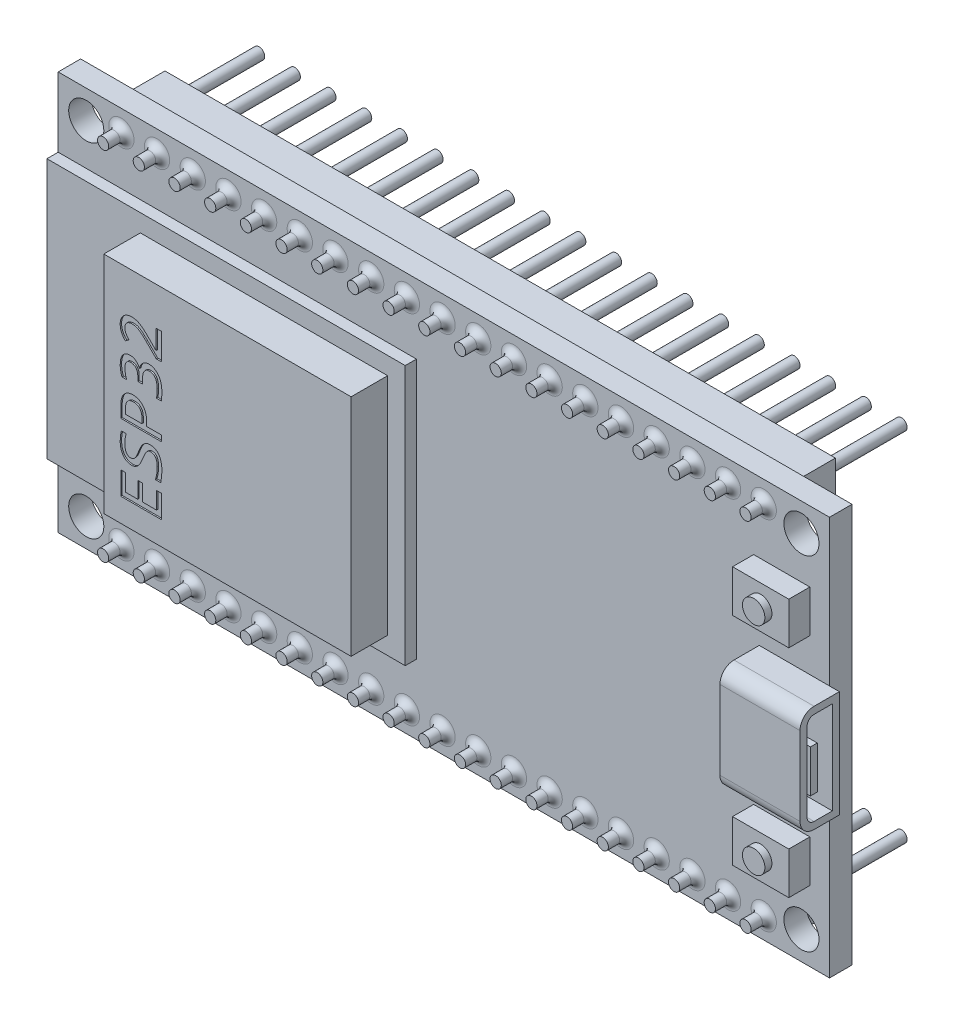
from build123d import *

# Parameters (mm, degrees)
SKETCH1_W           = 54.9
SKETCH1_H           = 28.4
SKETCH1_R           = 1.25
BOSS_EXTRUDE1_DEPTH = 1.6
BOSS_EXTRUDE2_DEPTH = 2.8
FILLET1_R           = 1
SKETCH3_W           = 0.489205705
SKETCH3_H           = 3.024180721
CUT_EXTRUDE1_DEPTH  = 5
SKETCH4_W           = 4
SKETCH4_H           = 3
BOSS_EXTRUDE3_DEPTH = 1.5
SKETCH5_R           = 0.8
BOSS_EXTRUDE4_DEPTH = 0.5
SKETCH6_W           = 25.5
SKETCH6_H           = 18.5
BOSS_EXTRUDE5_DEPTH = 0.8
SKETCH7_W           = 17.6
SKETCH7_H           = 16
BOSS_EXTRUDE6_DEPTH = 2.6
CUT_EXTRUDE2_DEPTH  = 0.1
SKETCH9_R           = 0.4
BOSS_EXTRUDE7_DEPTH = 1.3
BOSS_EXTRUDE8_START = -9.8
SKETCH9_2_R         = 0.4
BOSS_EXTRUDE8_DEPTH = 9.8
FILLET2_R           = 0.5
SKETCH10_W          = 47.72
SKETCH10_H          = 2.51
BOSS_EXTRUDE9_DEPTH = 2.5


with BuildPart() as part:
    # Sketch1 → Boss-Extrude1 (new body)
    with BuildSketch(Plane.XY):
        with Locations((27.45, 14.2)):
            Rectangle(SKETCH1_W, SKETCH1_H)
        with Locations((2, 26.4)):
            Circle(SKETCH1_R, mode=Mode.SUBTRACT)
        with Locations((52.9, 26.4)):
            Circle(SKETCH1_R, mode=Mode.SUBTRACT)
        with Locations((2, 2)):
            Circle(SKETCH1_R, mode=Mode.SUBTRACT)
        with Locations((52.9, 2)):
            Circle(SKETCH1_R, mode=Mode.SUBTRACT)
    extrude(amount=BOSS_EXTRUDE1_DEPTH)

    # Sketch2 → Boss-Extrude2 (add)
    with BuildSketch(Plane.XY.offset(1.6)):
        Polygon((54.9, 18), (49.9, 18), (49.9, 10.4), (54.9, 10.4), (55.6, 10.4), (55.6, 18), align=None)
    extrude(amount=BOSS_EXTRUDE2_DEPTH)

    # Fillet1
    fillet1_edges = [part.edges().sort_by_distance(p)[0] for p in [
        (52.75, 18, 4.4),
        (52.75, 10.4, 4.4),
    ]]
    fillet(fillet1_edges, radius=FILLET1_R)

    # Sketch3 → Cut-Extrude1 (cut)
    with BuildSketch(Plane(origin=(55.6, 0, 0), x_dir=(0, 0, -1), z_dir=(1, 0, 0))):
        with BuildLine():
            Line((-2.1, 17.5), (-3.4, 17.5))
            ThreePointArc((-3.4, 17.5), (-3.753553391, 17.353553391), (-3.9, 17))
            Line((-3.9, 17), (-3.9, 11.4))
            ThreePointArc((-3.9, 11.4), (-3.753553391, 11.046446609), (-3.4, 10.9))
            Line((-3.4, 10.9), (-2.1, 10.9))
            Line((-2.1, 10.9), (-2.1, 17.5))
        make_face()
        with Locations((-3.417595476, 14.11048563)):
            Rectangle(SKETCH3_W, SKETCH3_H, mode=Mode.SUBTRACT)
    extrude(amount=-CUT_EXTRUDE1_DEPTH, mode=Mode.SUBTRACT)

    # Sketch4 → Boss-Extrude3 (add)
    with BuildSketch(Plane.XY.offset(1.6)):
        with Locations((51.5, 21.9)):
            Rectangle(SKETCH4_W, SKETCH4_H)
        with Locations((51.5, 6.5)):
            Rectangle(SKETCH4_W, SKETCH4_H)
    extrude(amount=BOSS_EXTRUDE3_DEPTH)

    # Sketch5 → Boss-Extrude4 (add)
    with BuildSketch(Plane.XY.offset(3.1)):
        with Locations((51.5, 21.9)):
            Circle(SKETCH5_R)
        with Locations((51.5, 6.5)):
            Circle(SKETCH5_R)
    extrude(amount=BOSS_EXTRUDE4_DEPTH)

    # Sketch6 → Boss-Extrude5 (add)
    with BuildSketch(Plane.XY.offset(1.6)):
        with Locations((12.75, 14.2)):
            Rectangle(SKETCH6_W, SKETCH6_H)
    extrude(amount=BOSS_EXTRUDE5_DEPTH)

    # Sketch7 → Boss-Extrude6 (add)
    with BuildSketch(Plane.XY.offset(2.4)):
        with Locations((15.45, 14.2)):
            Rectangle(SKETCH7_W, SKETCH7_H)
    extrude(amount=BOSS_EXTRUDE6_DEPTH)

    # Sketch8 → Cut-Extrude2 (cut)
    # profile 1 of 5: a face of its own
    with BuildSketch(Plane.XY.offset(5)):
        with BuildLine():
            Line((10.738577218, 19.485077523), (10.738577218, 17.605515809))
            Line((10.738577218, 17.605515809), (10.38420152, 17.605515809))
            Line((10.38420152, 17.605515809), (9.650650351, 18.331235471))
            add(Edge.make_bspline(
                [(9.650650351, 18.331235471), (9.621736048, 18.359533503), (9.566322153, 18.413766325), (9.486505819, 18.491312946), (9.411070001, 18.559015302), (9.341667701, 18.619541453), (9.276767273, 18.67317388), (9.214576426, 18.719276682), (9.156058738, 18.760322093), (9.099485204, 18.794145067), (9.04575919, 18.823531427), (8.993242339, 18.846850225), (8.942528957, 18.866458053), (8.875189818, 18.883420175), (8.788697366, 18.897750989), (8.718335305, 18.899450879), (8.682153967, 18.90032499)],
                knots=[0, 0, 0, 0, 1.467781628, 2.812984966, 4.036667351, 5.144376027, 6.153886057, 7.089890156, 7.952406517, 8.745552503, 9.479984163, 10.172333011, 10.829086416, 11.449306875, 12.688391322, 14, 14, 14, 14], degree=3))
            add(Edge.make_bspline(
                [(8.682153967, 18.90032499), (8.647237101, 18.898950291), (8.578288841, 18.896235755), (8.494414603, 18.878104905), (8.430917501, 18.857779569), (8.387138734, 18.836990652), (8.345673986, 18.813559914), (8.307056745, 18.78637151), (8.272372916, 18.754515343), (8.2402365, 18.719384756), (8.214131523, 18.678201114), (8.189886147, 18.633996088), (8.172037638, 18.58437503), (8.158009144, 18.530733893), (8.150391299, 18.472201804), (8.149446968, 18.431759742), (8.148958856, 18.410855794)],
                knots=[0, 0, 0, 0, 1.786216299, 3.527135121, 4.372416622, 5.194637262, 6.0027823, 6.80939094, 7.605785013, 8.410469029, 9.238327819, 10.095268927, 10.986900131, 11.929653777, 12.929866349, 14, 14, 14, 14], degree=3))
            add(Edge.make_bspline(
                [(8.148958856, 18.410855794), (8.150002954, 18.381645022), (8.152066227, 18.323920733), (8.167220582, 18.239370488), (8.192973898, 18.158971451), (8.22854969, 18.082942429), (8.272988448, 18.011083026), (8.323267325, 17.94220142), (8.378856271, 17.875438779), (8.420314573, 17.834473796), (8.441335123, 17.813703374)],
                knots=[0, 0, 0, 0, 1.023841796, 2.023244705, 3.000130015, 3.976032288, 4.95838074, 5.957638122, 6.964463877, 8, 8, 8, 8], degree=3))
            Line((8.441335123, 17.813703374), (8.190074268, 17.605515809))
            add(Edge.make_bspline(
                [(8.190074268, 17.605515809), (8.162538759, 17.632846628), (8.107639506, 17.687337778), (8.035447269, 17.778110376), (7.971232888, 17.874365257), (7.914980523, 17.976687447), (7.869293189, 18.086862526), (7.837619871, 18.205995257), (7.818457104, 18.33344084), (7.816050778, 18.421228752), (7.814814551, 18.466328969)],
                knots=[0, 0, 0, 0, 0.961904287, 1.917808245, 2.871393154, 3.830279184, 4.810558542, 5.822670133, 6.881417188, 8, 8, 8, 8], degree=3))
            add(Edge.make_bspline(
                [(7.814814551, 18.466328969), (7.815284462, 18.497259929), (7.816204368, 18.557810961), (7.828028279, 18.646374328), (7.845324741, 18.730958857), (7.869858842, 18.811354862), (7.90243033, 18.88657433), (7.939602795, 18.9573623), (7.984904623, 19.021934002), (8.035671541, 19.08131574), (8.092615743, 19.135450946), (8.15648166, 19.182054665), (8.22520774, 19.224039044), (8.30090082, 19.257464264), (8.381497994, 19.285329796), (8.467673777, 19.303601521), (8.558230785, 19.315979284), (8.62032783, 19.317319122), (8.65213319, 19.318005371)],
                knots=[0, 0, 0, 0, 1.101024146, 2.155385717, 3.176652834, 4.17421508, 5.142857198, 6.092783762, 7.017080387, 7.945816332, 8.872221856, 9.808299192, 10.757150569, 11.735138951, 12.749622124, 13.789302431, 14.867707268, 16, 16, 16, 16], degree=3))
            add(Edge.make_bspline(
                [(8.65213319, 19.318005371), (8.679124298, 19.317496786), (8.732352465, 19.316493824), (8.810525731, 19.308798331), (8.885515664, 19.294857117), (8.957923718, 19.275806552), (9.028878423, 19.251247911), (9.099536139, 19.22211486), (9.169408619, 19.186360978), (9.239695831, 19.145828981), (9.310015852, 19.098954895), (9.382273909, 19.047737886), (9.45430958, 18.988894764), (9.529116192, 18.92579255), (9.605219262, 18.855783155), (9.685995286, 18.781707537), (9.769255183, 18.700453022), (9.825822657, 18.644111088), (9.854922162, 18.615127605)],
                knots=[0, 0, 0, 0, 0.903006108, 1.780784919, 2.6244971, 3.452490889, 4.283422647, 5.135009645, 6.007370111, 6.907467505, 7.848200552, 8.833923043, 9.869470176, 10.958941075, 12.108048799, 13.328693938, 14.62582365, 16, 16, 16, 16], degree=3))
            Line((9.854922162, 18.615127605), (10.362664875, 18.106732266))
            Line((10.362664875, 18.106732266), (10.362664875, 19.485077523))
            Line((10.362664875, 19.485077523), (10.738577218, 19.485077523))
        make_face()
    # profile 2 of 5: a face of its own
    with BuildSketch(Plane.XY.offset(5)):
        with BuildLine():
            add(Edge.make_bspline(
                [(9.851659034, 17.020763276), (9.883249543, 17.019653823), (9.945883565, 17.017454128), (10.038410423, 17.003086694), (10.127780775, 16.977815434), (10.214058073, 16.943538525), (10.295821925, 16.898537581), (10.373613677, 16.845430656), (10.444251937, 16.780099765), (10.510440116, 16.706322675), (10.570676272, 16.622470458), (10.623625448, 16.528206489), (10.669838379, 16.423892055), (10.709576751, 16.30959009), (10.741551692, 16.185452586), (10.764110075, 16.051419999), (10.777927689, 15.907675442), (10.779522957, 15.808434844), (10.780345256, 15.757280123)],
                knots=[0, 0, 0, 0, 0.862000906, 1.709076045, 2.547265718, 3.391591147, 4.236250351, 5.089190827, 5.954842265, 6.854464594, 7.790140503, 8.765673628, 9.799288264, 10.899351906, 12.064056353, 13.292653574, 14.604466791, 16, 16, 16, 16], degree=3))
            add(Edge.make_bspline(
                [(10.780345256, 15.757280123), (10.780078733, 15.702004152), (10.779573596, 15.597240275), (10.769549857, 15.447754456), (10.756934251, 15.311438446), (10.744570811, 15.224914833), (10.738577218, 15.182969599)],
                knots=[0, 0, 0, 0, 1.150537757, 2.180600223, 3.117984723, 4, 4, 4, 4], degree=3))
            Line((10.738577218, 15.182969599), (10.404432913, 15.182969599))
            add(Edge.make_bspline(
                [(10.404432913, 15.182969599), (10.410679599, 15.230352788), (10.423463202, 15.327320672), (10.435870677, 15.476706681), (10.444944674, 15.631429595), (10.445780068, 15.736382192), (10.446200951, 15.789258777)],
                knots=[0, 0, 0, 0, 0.942848368, 1.929503111, 2.956854718, 4, 4, 4, 4], degree=3))
            add(Edge.make_bspline(
                [(10.446200951, 15.789258777), (10.445660305, 15.824293118), (10.444614755, 15.892045703), (10.437780955, 15.98950741), (10.425272627, 16.079070487), (10.408486757, 16.160889786), (10.387268446, 16.235458982), (10.360958009, 16.302724505), (10.330644407, 16.362833053), (10.295610585, 16.415669047), (10.256983848, 16.462042293), (10.213829503, 16.501186365), (10.166770957, 16.533929193), (10.115520535, 16.559155904), (10.061105524, 16.578579558), (10.003504136, 16.593325343), (9.942408575, 16.601741262), (9.900413574, 16.602630787), (9.879069309, 16.603082895)],
                knots=[0, 0, 0, 0, 1.490206093, 2.881895635, 4.152536341, 5.33392715, 6.432085301, 7.445878695, 8.401816679, 9.289775243, 10.136874663, 10.962216482, 11.760452457, 12.567382849, 13.384016582, 14.214374466, 15.092442814, 16, 16, 16, 16], degree=3))
            add(Edge.make_bspline(
                [(9.879069309, 16.603082895), (9.859670605, 16.602475787), (9.821916859, 16.601294236), (9.767102273, 16.591539723), (9.716582208, 16.574237192), (9.669704251, 16.551396017), (9.627103575, 16.522101213), (9.587413187, 16.488175307), (9.552308688, 16.44773813), (9.520073227, 16.402665433), (9.492406614, 16.352296215), (9.467839298, 16.297615633), (9.448046337, 16.237998438), (9.430996385, 16.174191289), (9.418142921, 16.106549641), (9.409197274, 16.035481944), (9.40304489, 15.961441596), (9.402351957, 15.910877505), (9.401999999, 15.88519474)],
                knots=[0, 0, 0, 0, 0.962577253, 1.873367235, 2.750969479, 3.605753726, 4.453345862, 5.310718099, 6.190443685, 7.104301169, 8.056648313, 9.037941432, 10.076053636, 11.170911826, 12.314528068, 13.490518149, 14.725371476, 16, 16, 16, 16], degree=3))
            Line((9.401999999, 15.88519474), (9.401999999, 15.558881942))
            Line((9.401999999, 15.558881942), (9.067855694, 15.558881942))
            Line((9.067855694, 15.558881942), (9.067855694, 15.894984124))
            add(Edge.make_bspline(
                [(9.067855694, 15.894984124), (9.06755204, 15.91632193), (9.066955618, 15.958232463), (9.060143796, 16.019504536), (9.049776517, 16.077967035), (9.035497866, 16.133429703), (9.017381262, 16.185710158), (8.995227208, 16.233965867), (8.969508421, 16.278399369), (8.940064272, 16.318713553), (8.907733616, 16.355768804), (8.870406513, 16.387223384), (8.830021734, 16.414748137), (8.785944293, 16.437567966), (8.739068246, 16.456169563), (8.688501744, 16.468236869), (8.635213481, 16.476394748), (8.598432607, 16.477311613), (8.579691749, 16.47777878)],
                knots=[0, 0, 0, 0, 1.192955268, 2.343136477, 3.443387262, 4.511688449, 5.542971428, 6.533842038, 7.477103137, 8.409233689, 9.322674014, 10.220090696, 11.131259182, 12.050998613, 12.990958013, 13.944133247, 14.952479831, 16, 16, 16, 16], degree=3))
            add(Edge.make_bspline(
                [(8.579691749, 16.47777878), (8.561606135, 16.477543867), (8.526367423, 16.477086153), (8.475720838, 16.469518232), (8.428608996, 16.458614348), (8.385372854, 16.442991974), (8.345781636, 16.422717972), (8.310205271, 16.397448873), (8.277881451, 16.368274773), (8.250585008, 16.33360422), (8.226104227, 16.295449706), (8.205257675, 16.252696237), (8.187950141, 16.205824825), (8.173311591, 16.1548229), (8.16254654, 16.099769688), (8.154943253, 16.0404606), (8.149267729, 15.977105863), (8.149064069, 15.933285364), (8.148958856, 15.910647138)],
                knots=[0, 0, 0, 0, 1.063902117, 2.07294813, 3.008146373, 3.907750858, 4.772858431, 5.618688894, 6.470897239, 7.327139502, 8.208408171, 9.136473106, 10.121490767, 11.14730967, 12.257700006, 13.420778618, 14.667541449, 16, 16, 16, 16], degree=3))
            add(Edge.make_bspline(
                [(8.148958856, 15.910647138), (8.150527186, 15.860310314), (8.153734257, 15.757376819), (8.174349597, 15.628384079), (8.197643088, 15.52239848), (8.21928763, 15.439478046), (8.244795784, 15.353729514), (8.264288094, 15.296031635), (8.27426297, 15.266505675)],
                knots=[0, 0, 0, 0, 1.374009053, 2.809703548, 3.557729416, 4.33717134, 5.149074242, 6, 6, 6, 6], degree=3))
            Line((8.27426297, 15.266505675), (7.940118665, 15.266505675))
            add(Edge.make_bspline(
                [(7.940118665, 15.266505675), (7.930465258, 15.292945746), (7.910776028, 15.346873299), (7.886532187, 15.430706937), (7.865374821, 15.516778075), (7.846593751, 15.603475622), (7.833381313, 15.690300114), (7.822811257, 15.776015262), (7.81586483, 15.859845666), (7.815159681, 15.914985403), (7.814814551, 15.941973167)],
                knots=[0, 0, 0, 0, 0.97828254, 1.995319307, 3.031658837, 4.059547585, 5.077848887, 6.083433287, 7.061949656, 8, 8, 8, 8], degree=3))
            add(Edge.make_bspline(
                [(7.814814551, 15.941973167), (7.815436186, 15.980063923), (7.816638725, 16.053749596), (7.826013449, 16.160755601), (7.840529303, 16.260741436), (7.862018271, 16.353721883), (7.889654825, 16.439279568), (7.921230395, 16.518298448), (7.959110351, 16.589607781), (8.002408703, 16.653549296), (8.050939712, 16.709909417), (8.104142882, 16.759460155), (8.16241408, 16.801442492), (8.225714801, 16.835542445), (8.293416138, 16.862350902), (8.365127387, 16.882064834), (8.441207611, 16.893148408), (8.49307495, 16.89467631), (8.519650194, 16.895459161)],
                knots=[0, 0, 0, 0, 1.364362879, 2.639327927, 3.845081581, 4.981203076, 6.053296419, 7.063437936, 8.025666777, 8.939996343, 9.824170202, 10.68446093, 11.538765414, 12.389614983, 13.253568937, 14.142128063, 15.048083035, 16, 16, 16, 16], degree=3))
            add(Edge.make_bspline(
                [(8.519650194, 16.895459161), (8.539456767, 16.895070113), (8.578506404, 16.894303084), (8.635980949, 16.888632979), (8.690789413, 16.877764307), (8.743450302, 16.864573744), (8.79323384, 16.845788392), (8.841159968, 16.823942683), (8.886008217, 16.79685039), (8.943267949, 16.756406212), (9.009483262, 16.69699519), (9.079505976, 16.613484873), (9.142642012, 16.519180008), (9.175159843, 16.44913175), (9.191854557, 16.413168846)],
                knots=[0, 0, 0, 0, 0.808629916, 1.594253862, 2.353688901, 3.088257457, 3.807581306, 4.522781345, 5.235606306, 5.942821229, 7.383249685, 8.851339496, 10.383471904, 12, 12, 12, 12], degree=3))
            add(Edge.make_bspline(
                [(9.191854557, 16.413168846), (9.19959452, 16.450496254), (9.21527422, 16.526114511), (9.261144286, 16.634518318), (9.321375388, 16.737249532), (9.385903867, 16.813857061), (9.4439126, 16.869130505), (9.492333341, 16.905708655), (9.543484324, 16.93983063), (9.598954473, 16.968201045), (9.657555481, 16.991924938), (9.719451998, 17.009097981), (9.784554365, 17.018941404), (9.829001374, 17.020148127), (9.851659034, 17.020763276)],
                knots=[0, 0, 0, 0, 1.405029343, 2.846323322, 4.323450548, 5.789369391, 6.528282537, 7.278767976, 8.027531129, 8.796539371, 9.575348541, 10.358950429, 11.163445528, 12, 12, 12, 12], degree=3))
        make_face()
    # profile 3 of 5: a face of its own
    with BuildSketch(Plane.XY.offset(5)):
        with BuildLine():
            add(Edge.make_bspline(
                [(8.733711389, 14.556449028), (8.76290704, 14.555744482), (8.82156085, 14.554329057), (8.90911765, 14.541236841), (8.996232185, 14.521024691), (9.082391651, 14.49297144), (9.166438811, 14.457077871), (9.246060509, 14.410602849), (9.321162534, 14.35580758), (9.391437334, 14.291989115), (9.456326968, 14.219411673), (9.514594313, 14.136909956), (9.566848776, 14.045450821), (9.611899935, 13.944279188), (9.649483139, 13.833771717), (9.676063543, 13.712574009), (9.691575115, 13.581181086), (9.693422365, 13.490102018), (9.694376266, 13.443069762)],
                knots=[0, 0, 0, 0, 0.848366681, 1.70436134, 2.568101873, 3.44615045, 4.335605672, 5.219738008, 6.120455434, 7.033895829, 7.974606513, 8.94512196, 9.964958472, 11.032269508, 12.160312669, 13.352609154, 14.632915689, 16, 16, 16, 16], degree=3))
            Line((9.694376266, 13.443069762), (9.694376266, 13.094567694))
            Line((9.694376266, 13.094567694), (10.738577218, 13.094567694))
            Line((10.738577218, 13.094567694), (10.738577218, 12.676887313))
            Line((10.738577218, 12.676887313), (7.856582589, 12.676887313))
            Line((7.856582589, 12.676887313), (7.856582589, 13.482879923))
            add(Edge.make_bspline(
                [(7.856582589, 13.482879923), (7.857330751, 13.517915882), (7.858815261, 13.587434515), (7.866987287, 13.690615346), (7.882618217, 13.791347658), (7.901942294, 13.889797107), (7.929498037, 13.984003449), (7.962858515, 14.073395453), (8.005384176, 14.156105515), (8.0540305, 14.233572822), (8.110911282, 14.304144895), (8.175297946, 14.367532191), (8.247939135, 14.422501655), (8.327821064, 14.470638831), (8.416618931, 14.509713074), (8.514713226, 14.536397425), (8.621253178, 14.55414564), (8.695346406, 14.55566323), (8.733711389, 14.556449028)],
                knots=[0, 0, 0, 0, 1.071168916, 2.125422097, 3.160883342, 4.185978661, 5.189866953, 6.158124041, 7.097919914, 8.02771025, 8.949955167, 9.862244431, 10.782641377, 11.728090455, 12.707834548, 13.737299276, 14.82838854, 16, 16, 16, 16], degree=3))
        make_face()
        with BuildLine():
            add(Edge.make_bspline(
                [(8.755900659, 14.138768647), (8.733681641, 14.138351999), (8.690375944, 14.137539936), (8.627660829, 14.128810695), (8.568873437, 14.115064606), (8.514064716, 14.096340446), (8.463071518, 14.072067155), (8.416591395, 14.041716326), (8.373654237, 14.006249555), (8.335272707, 13.965065952), (8.301487309, 13.918974698), (8.270947387, 13.869359328), (8.246268501, 13.814620215), (8.226262508, 13.7555105), (8.209631689, 13.692356616), (8.199165617, 13.624546245), (8.191394675, 13.552890972), (8.190953054, 13.503569701), (8.190726894, 13.478311544)],
                knots=[0, 0, 0, 0, 1.07893025, 2.102875295, 3.069403633, 4.00867391, 4.911619206, 5.805799344, 6.69897942, 7.61127936, 8.532960211, 9.47193309, 10.436783978, 11.442898866, 12.50165651, 13.605056338, 14.773513735, 16, 16, 16, 16], degree=3))
            Line((8.190726894, 13.478311544), (8.190726894, 13.094567694))
            Line((8.190726894, 13.094567694), (9.360231961, 13.094567694))
            Line((9.360231961, 13.094567694), (9.360231961, 13.445027639))
            add(Edge.make_bspline(
                [(9.360231961, 13.445027639), (9.359638468, 13.472012628), (9.358488003, 13.524322095), (9.352239842, 13.600713984), (9.340417141, 13.672220264), (9.324562596, 13.739247828), (9.302504772, 13.800756668), (9.277422535, 13.858210447), (9.246433726, 13.910547001), (9.211227624, 13.958408791), (9.171335301, 14.001423071), (9.125717971, 14.037959221), (9.075956543, 14.069576998), (9.021152088, 14.095277308), (8.961405697, 14.114513665), (8.897222425, 14.128953422), (8.828140059, 14.137539428), (8.780507772, 14.138349934), (8.755900659, 14.138768647)],
                knots=[0, 0, 0, 0, 1.232741143, 2.389626019, 3.497154964, 4.540654912, 5.530551031, 6.477891969, 7.399827849, 8.302062897, 9.187787369, 10.070776652, 10.963938254, 11.875156404, 12.827227449, 13.825219082, 14.876495724, 16, 16, 16, 16], degree=3))
        make_face(mode=Mode.SUBTRACT)
    # profile 4 of 5: a face of its own
    with BuildSketch(Plane.XY.offset(5)):
        with BuildLine():
            add(Edge.make_bspline(
                [(9.958689632, 12.09213478), (9.992033274, 12.091174562), (10.05693399, 12.089305576), (10.151128493, 12.073559711), (10.238509492, 12.046566031), (10.319709315, 12.009765472), (10.393976826, 11.963255101), (10.462221072, 11.90837498), (10.52358692, 11.845001286), (10.577831935, 11.772929064), (10.626539626, 11.693882366), (10.667315317, 11.606200934), (10.702596817, 11.511534381), (10.731127429, 11.409540307), (10.752900557, 11.301059083), (10.769480132, 11.186941773), (10.778323888, 11.06721871), (10.779662497, 10.985729873), (10.780345256, 10.944166358)],
                knots=[0, 0, 0, 0, 1.005542668, 1.957207907, 2.870649987, 3.757654935, 4.639106304, 5.50728757, 6.393806754, 7.292990278, 8.223879093, 9.189763998, 10.205281347, 11.269088171, 12.381198635, 13.541420952, 14.745997712, 16, 16, 16, 16], degree=3))
            add(Edge.make_bspline(
                [(10.780345256, 10.944166358), (10.780011847, 10.905868558), (10.779346532, 10.829445774), (10.77268222, 10.715912521), (10.7654551, 10.604663933), (10.754553149, 10.497693302), (10.743465177, 10.395499283), (10.728616943, 10.299915882), (10.714371664, 10.211387653), (10.7024607, 10.155537024), (10.69680918, 10.129036989)],
                knots=[0, 0, 0, 0, 1.119774364, 2.234495903, 3.324975685, 4.379535058, 5.378502437, 6.330339078, 7.20777842, 8, 8, 8, 8], degree=3))
            Line((10.69680918, 10.129036989), (10.320896837, 10.129036989))
            add(Edge.make_bspline(
                [(10.320896837, 10.129036989), (10.330622497, 10.157422271), (10.35049447, 10.215420554), (10.373802491, 10.306396263), (10.395692325, 10.401826801), (10.413979919, 10.502618982), (10.428373151, 10.609754766), (10.438495736, 10.723642911), (10.445350668, 10.844666002), (10.445912245, 10.927623094), (10.446200951, 10.970271381)],
                knots=[0, 0, 0, 0, 0.842364813, 1.72116351, 2.635659137, 3.591954833, 4.596841017, 5.670471508, 6.802388115, 8, 8, 8, 8], degree=3))
            add(Edge.make_bspline(
                [(10.446200951, 10.970271381), (10.445887289, 11.00074153), (10.445283975, 11.059349531), (10.438976458, 11.143800674), (10.430753056, 11.221350483), (10.416469671, 11.291831856), (10.400029436, 11.355952301), (10.379108465, 11.413908742), (10.354211951, 11.465611356), (10.326299637, 11.511956582), (10.294057099, 11.551689581), (10.259283164, 11.586475441), (10.220429792, 11.614678825), (10.178287026, 11.636813478), (10.133412412, 11.654104919), (10.085326203, 11.665558506), (10.034185927, 11.672932795), (9.998961597, 11.673938244), (9.980878902, 11.674454399)],
                knots=[0, 0, 0, 0, 1.523249472, 2.929903915, 4.233296251, 5.419431577, 6.522341058, 7.540917397, 8.494515215, 9.388156094, 10.239274487, 11.04695073, 11.841108735, 12.62943441, 13.421354294, 14.239221521, 15.096090076, 16, 16, 16, 16], degree=3))
            add(Edge.make_bspline(
                [(9.980878902, 11.674454399), (9.962091386, 11.673806365), (9.925384531, 11.672540243), (9.872723039, 11.659607682), (9.823887846, 11.639387698), (9.780334034, 11.609744232), (9.739411979, 11.574907822), (9.701912588, 11.533983789), (9.665658585, 11.488806211), (9.620029093, 11.420273599), (9.566670899, 11.324166998), (9.511892442, 11.19690817), (9.459358972, 11.060888909), (9.402839877, 10.922101457), (9.343671959, 10.782785215), (9.279306858, 10.647078453), (9.208296195, 10.518181157), (9.135267243, 10.422953143), (9.071447188, 10.354888663), (9.019583311, 10.309394237), (8.962994505, 10.269841609), (8.903218832, 10.233942084), (8.837757208, 10.205477946), (8.766850011, 10.185578941), (8.690239277, 10.172623734), (8.637178747, 10.171425355), (8.609712526, 10.170805027)],
                knots=[0, 0, 0, 0, 0.619856703, 1.211069627, 1.781317632, 2.357652662, 2.944124569, 3.554568585, 4.189016027, 4.857081954, 6.273378886, 7.815244584, 9.432151164, 11.09313998, 12.767999346, 14.433898664, 16.057028127, 17.6216601, 18.384562662, 19.138741378, 19.896851429, 20.66387654, 21.439947467, 22.247841025, 23.093013471, 24, 24, 24, 24], degree=3))
            add(Edge.make_bspline(
                [(8.609712526, 10.170805027), (8.585082956, 10.17155382), (8.535763301, 10.173053245), (8.462067888, 10.185439084), (8.389017218, 10.204919756), (8.316872987, 10.232341992), (8.247320203, 10.268274283), (8.180594308, 10.311957535), (8.119223052, 10.365895169), (8.060674496, 10.427045777), (8.007638774, 10.498347218), (7.960157705, 10.578712754), (7.918512223, 10.668566856), (7.880945756, 10.767038061), (7.851054031, 10.875793544), (7.829658593, 10.994357809), (7.817578231, 11.12273522), (7.815756902, 11.211499997), (7.814814551, 11.257426643)],
                knots=[0, 0, 0, 0, 0.784008501, 1.569943279, 2.373275585, 3.189059721, 4.022597455, 4.862331727, 5.722035901, 6.618905113, 7.554234865, 8.545209567, 9.586587379, 10.704826919, 11.898277364, 13.172984207, 14.537309982, 16, 16, 16, 16], degree=3))
            add(Edge.make_bspline(
                [(7.814814551, 11.257426643), (7.815320011, 11.283101237), (7.816370131, 11.336441658), (7.820935408, 11.418735491), (7.828777679, 11.504471406), (7.839350939, 11.591690421), (7.851572225, 11.678756674), (7.865939555, 11.764235229), (7.881283802, 11.846290481), (7.89279418, 11.899416777), (7.898350627, 11.925062627)],
                knots=[0, 0, 0, 0, 0.914358742, 1.899632051, 2.934074914, 3.979452354, 5.027838988, 6.06445484, 7.065647236, 8, 8, 8, 8], degree=3))
            Line((7.898350627, 11.925062627), (8.232494932, 11.925062627))
            add(Edge.make_bspline(
                [(8.232494932, 11.925062627), (8.219928316, 11.867966173), (8.194912608, 11.754307229), (8.16839842, 11.583520923), (8.152164247, 11.415461567), (8.150014676, 11.304667351), (8.148958856, 11.250247762)],
                knots=[0, 0, 0, 0, 1.029354975, 2.049083439, 3.041754323, 4, 4, 4, 4], degree=3))
            add(Edge.make_bspline(
                [(8.148958856, 11.250247762), (8.149377934, 11.222830656), (8.150190272, 11.169685562), (8.155184782, 11.092746072), (8.164330661, 11.02150593), (8.176700431, 10.955892758), (8.192008204, 10.89572523), (8.211456063, 10.841188519), (8.235194739, 10.792583079), (8.261866643, 10.749091106), (8.292060626, 10.711351146), (8.324115442, 10.67817462), (8.358971563, 10.650475829), (8.396622777, 10.628117029), (8.436568489, 10.610619483), (8.478641662, 10.597030491), (8.523556482, 10.590133561), (8.554219798, 10.589043112), (8.569902365, 10.588485408)],
                knots=[0, 0, 0, 0, 1.491437277, 2.890989782, 4.191431573, 5.395946596, 6.521058188, 7.565423013, 8.539223212, 9.458660202, 10.334655275, 11.163081303, 11.963306063, 12.748694206, 13.538083787, 14.331542868, 15.146677777, 16, 16, 16, 16], degree=3))
            add(Edge.make_bspline(
                [(8.569902365, 10.588485408), (8.588690543, 10.589129041), (8.625398692, 10.590386564), (8.678246752, 10.603428935), (8.727177617, 10.623497744), (8.771615558, 10.652572819), (8.812195024, 10.688076827), (8.851091286, 10.728233233), (8.887670154, 10.773512034), (8.934394604, 10.841956757), (8.987924404, 10.938514807), (9.042652812, 11.066173201), (9.096158098, 11.20189908), (9.152502421, 11.340839616), (9.211540928, 11.480315428), (9.266352, 11.594029489), (9.313425319, 11.682274876), (9.352884603, 11.744116544), (9.394499638, 11.802838401), (9.440484029, 11.856821341), (9.489087143, 11.907524705), (9.542496774, 11.952573454), (9.599097769, 11.993377703), (9.660523192, 12.028177104), (9.726560751, 12.057686434), (9.798991441, 12.077287536), (9.876856627, 12.090331681), (9.930786228, 12.091519959), (9.958689632, 12.09213478)],
                knots=[0, 0, 0, 0, 0.667490157, 1.304135379, 1.925338702, 2.541746512, 3.184203398, 3.84128389, 4.529338779, 5.253104542, 6.788775438, 8.449127214, 10.193159048, 11.981788067, 13.78535353, 15.582625783, 16.473069092, 17.343045967, 18.191816017, 19.032495598, 19.864754018, 20.688614347, 21.515778917, 22.344572585, 23.197569954, 24.082441501, 25.007847132, 26, 26, 26, 26], degree=3))
        make_face()
    # profile 5 of 5: a face of its own
    with BuildSketch(Plane.XY.offset(5)):
        Polygon((10.738577218, 9.502516418), (10.738577218, 7.873562932), (7.856582589, 7.873562932), (7.856582589, 9.502516418), (8.190726894, 9.502516418), (8.190726894, 8.291243313), (9.067855694, 8.291243313), (9.067855694, 9.454222124), (9.401999999, 9.454222124), (9.401999999, 8.291243313), (10.404432913, 8.291243313), (10.404432913, 9.502516418), align=None)
    extrude(amount=-CUT_EXTRUDE2_DEPTH, mode=Mode.SUBTRACT)

    # Sketch9 → Boss-Extrude7 (add)
    with BuildSketch(Plane.XY.offset(1.6)):
        with Locations((4.5, 26.9)):
            Circle(SKETCH9_R)
        with Locations((7.04, 26.9)):
            Circle(SKETCH9_R)
        with Locations((9.58, 26.9)):
            Circle(SKETCH9_R)
        with Locations((12.12, 26.9)):
            Circle(SKETCH9_R)
        with Locations((14.66, 26.9)):
            Circle(SKETCH9_R)
        with Locations((17.2, 26.9)):
            Circle(SKETCH9_R)
        with Locations((19.74, 26.9)):
            Circle(SKETCH9_R)
        with Locations((22.28, 26.9)):
            Circle(SKETCH9_R)
        with Locations((24.82, 26.9)):
            Circle(SKETCH9_R)
        with Locations((27.36, 26.9)):
            Circle(SKETCH9_R)
        with Locations((29.9, 26.9)):
            Circle(SKETCH9_R)
        with Locations((32.44, 26.9)):
            Circle(SKETCH9_R)
        with Locations((34.98, 26.9)):
            Circle(SKETCH9_R)
        with Locations((37.52, 26.9)):
            Circle(SKETCH9_R)
        with Locations((40.06, 26.9)):
            Circle(SKETCH9_R)
        with Locations((42.6, 26.9)):
            Circle(SKETCH9_R)
        with Locations((45.14, 26.9)):
            Circle(SKETCH9_R)
        with Locations((47.68, 26.9)):
            Circle(SKETCH9_R)
        with Locations((50.22, 26.9)):
            Circle(SKETCH9_R)
        with Locations((50.22, 1.5)):
            Circle(SKETCH9_R)
        with Locations((47.68, 1.5)):
            Circle(SKETCH9_R)
        with Locations((45.14, 1.5)):
            Circle(SKETCH9_R)
        with Locations((42.6, 1.5)):
            Circle(SKETCH9_R)
        with Locations((40.06, 1.5)):
            Circle(SKETCH9_R)
        with Locations((37.52, 1.5)):
            Circle(SKETCH9_R)
        with Locations((34.98, 1.5)):
            Circle(SKETCH9_R)
        with Locations((32.44, 1.5)):
            Circle(SKETCH9_R)
        with Locations((29.9, 1.5)):
            Circle(SKETCH9_R)
        with Locations((27.36, 1.5)):
            Circle(SKETCH9_R)
        with Locations((24.82, 1.5)):
            Circle(SKETCH9_R)
        with Locations((22.28, 1.5)):
            Circle(SKETCH9_R)
        with Locations((19.74, 1.5)):
            Circle(SKETCH9_R)
        with Locations((17.2, 1.5)):
            Circle(SKETCH9_R)
        with Locations((14.66, 1.5)):
            Circle(SKETCH9_R)
        with Locations((12.12, 1.5)):
            Circle(SKETCH9_R)
        with Locations((9.58, 1.5)):
            Circle(SKETCH9_R)
        with Locations((7.04, 1.5)):
            Circle(SKETCH9_R)
        with Locations((4.5, 1.5)):
            Circle(SKETCH9_R)
    extrude(amount=BOSS_EXTRUDE7_DEPTH)

    # Sketch9<2> → Boss-Extrude8 (add)
    with BuildSketch(Plane.XY.offset(1.6).offset(BOSS_EXTRUDE8_START)):
        with Locations((4.5, 26.9)):
            Circle(SKETCH9_2_R)
        with Locations((7.04, 26.9)):
            Circle(SKETCH9_2_R)
        with Locations((9.58, 26.9)):
            Circle(SKETCH9_2_R)
        with Locations((12.12, 26.9)):
            Circle(SKETCH9_2_R)
        with Locations((14.66, 26.9)):
            Circle(SKETCH9_2_R)
        with Locations((17.2, 26.9)):
            Circle(SKETCH9_2_R)
        with Locations((19.74, 26.9)):
            Circle(SKETCH9_2_R)
        with Locations((22.28, 26.9)):
            Circle(SKETCH9_2_R)
        with Locations((24.82, 26.9)):
            Circle(SKETCH9_2_R)
        with Locations((27.36, 26.9)):
            Circle(SKETCH9_2_R)
        with Locations((29.9, 26.9)):
            Circle(SKETCH9_2_R)
        with Locations((32.44, 26.9)):
            Circle(SKETCH9_2_R)
        with Locations((34.98, 26.9)):
            Circle(SKETCH9_2_R)
        with Locations((37.52, 26.9)):
            Circle(SKETCH9_2_R)
        with Locations((40.06, 26.9)):
            Circle(SKETCH9_2_R)
        with Locations((42.6, 26.9)):
            Circle(SKETCH9_2_R)
        with Locations((45.14, 26.9)):
            Circle(SKETCH9_2_R)
        with Locations((47.68, 26.9)):
            Circle(SKETCH9_2_R)
        with Locations((50.22, 26.9)):
            Circle(SKETCH9_2_R)
        with Locations((50.22, 1.5)):
            Circle(SKETCH9_2_R)
        with Locations((47.68, 1.5)):
            Circle(SKETCH9_2_R)
        with Locations((45.14, 1.5)):
            Circle(SKETCH9_2_R)
        with Locations((42.6, 1.5)):
            Circle(SKETCH9_2_R)
        with Locations((40.06, 1.5)):
            Circle(SKETCH9_2_R)
        with Locations((37.52, 1.5)):
            Circle(SKETCH9_2_R)
        with Locations((34.98, 1.5)):
            Circle(SKETCH9_2_R)
        with Locations((32.44, 1.5)):
            Circle(SKETCH9_2_R)
        with Locations((29.9, 1.5)):
            Circle(SKETCH9_2_R)
        with Locations((27.36, 1.5)):
            Circle(SKETCH9_2_R)
        with Locations((24.82, 1.5)):
            Circle(SKETCH9_2_R)
        with Locations((22.28, 1.5)):
            Circle(SKETCH9_2_R)
        with Locations((19.74, 1.5)):
            Circle(SKETCH9_2_R)
        with Locations((17.2, 1.5)):
            Circle(SKETCH9_2_R)
        with Locations((14.66, 1.5)):
            Circle(SKETCH9_2_R)
        with Locations((12.12, 1.5)):
            Circle(SKETCH9_2_R)
        with Locations((9.58, 1.5)):
            Circle(SKETCH9_2_R)
        with Locations((7.04, 1.5)):
            Circle(SKETCH9_2_R)
        with Locations((4.5, 1.5)):
            Circle(SKETCH9_2_R)
    extrude(amount=BOSS_EXTRUDE8_DEPTH)

    # Fillet2
    fillet2_edges = [part.edges().sort_by_distance(p)[0] for p in [
        (4.1, 26.9, 1.6),
        (6.64, 26.9, 1.6),
        (9.18, 26.9, 1.6),
        (11.72, 26.9, 1.6),
        (14.26, 26.9, 1.6),
        (16.8, 26.9, 1.6),
        (19.34, 26.9, 1.6),
        (21.88, 26.9, 1.6),
        (24.42, 26.9, 1.6),
        (26.96, 26.9, 1.6),
        (29.5, 26.9, 1.6),
        (32.04, 26.9, 1.6),
        (34.58, 26.9, 1.6),
        (37.12, 26.9, 1.6),
        (39.66, 26.9, 1.6),
        (42.2, 26.9, 1.6),
        (44.74, 26.9, 1.6),
        (47.28, 26.9, 1.6),
        (49.82, 26.9, 1.6),
        (37.12, 1.5, 1.6),
        (39.66, 1.5, 1.6),
        (42.2, 1.5, 1.6),
        (44.74, 1.5, 1.6),
        (47.28, 1.5, 1.6),
        (49.82, 1.5, 1.6),
        (34.58, 1.5, 1.6),
        (32.04, 1.5, 1.6),
        (29.5, 1.5, 1.6),
        (26.96, 1.5, 1.6),
        (24.42, 1.5, 1.6),
        (21.88, 1.5, 1.6),
        (19.34, 1.5, 1.6),
        (16.8, 1.5, 1.6),
        (14.26, 1.5, 1.6),
        (11.72, 1.5, 1.6),
        (9.18, 1.5, 1.6),
        (6.64, 1.5, 1.6),
        (4.1, 1.5, 1.6),
    ]]
    fillet(fillet2_edges, radius=FILLET2_R)

    # Sketch10 → Boss-Extrude9 (add)
    with BuildSketch(Plane(origin=(0, 0, 0), x_dir=(-1, 0, 0), z_dir=(0, 0, -1))):
        with Locations((-27.36, 26.905)):
            Rectangle(SKETCH10_W, SKETCH10_H)
        with Locations((-27.36, 1.505)):
            Rectangle(SKETCH10_W, SKETCH10_H)
    extrude(amount=BOSS_EXTRUDE9_DEPTH)


solid = part.part
